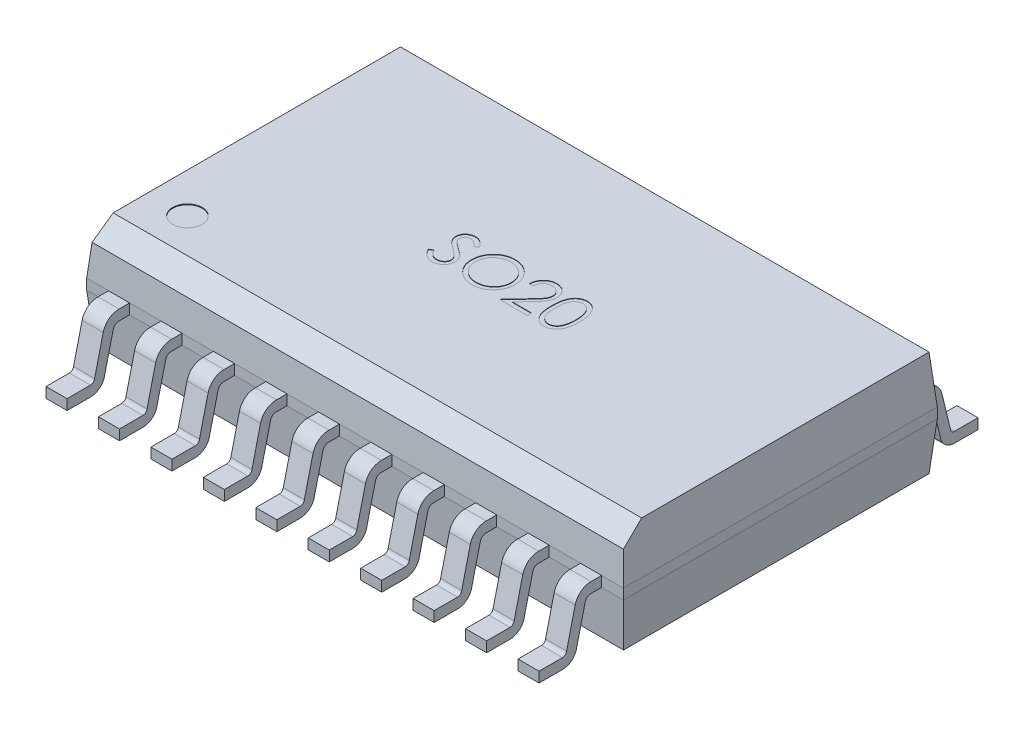
from build123d import *

# Parameters (mm, degrees)
BOSS_EXTRUDE1_DEPTH      = 0.125
BOSS_EXTRUDE1_DEPTH_BACK = 0.125
SKETCH1_W                = 13
SKETCH1_H                = 7.6
SKETCH2_W                = 13
SKETCH2_H                = 7.6
BOSS_EXTRUDE2_DEPTH      = 1.15
BOSS_EXTRUDE2_TAPER      = 5
SKETCH3_W                = 13
SKETCH3_H                = 7.6
BOSS_EXTRUDE3_DEPTH      = 1.15
BOSS_EXTRUDE3_TAPER      = 5
CHAMFER1_SIZE            = 0.4
CHAMFER1_SIZE2           = 0.440025147
BOSS_EXTRUDE4_START      = 0.38
BOSS_EXTRUDE4_DEPTH      = 0.51
LPATTERN1_COUNT          = 5
LPATTERN1_PITCH          = 1.27
LPATTERN1_COL_COUNT      = 6
LPATTERN1_COL_PITCH      = 1.27
SKETCH6_R                = 0.356697025
CUT_EXTRUDE1_DEPTH       = 0.02
CUT_EXTRUDE2_DEPTH       = 0.01


with BuildPart() as part:
    # Sketch1 → Boss-Extrude1 (new, two sides: drawn at the far end of the back side and taken through both)
    with BuildSketch(Plane(origin=(0, 1.38, 0), x_dir=(1, 0, 0), z_dir=(0, 1, 0)).offset(-BOSS_EXTRUDE1_DEPTH_BACK)):
        Rectangle(SKETCH1_W, SKETCH1_H)
    extrude(amount=BOSS_EXTRUDE1_DEPTH + BOSS_EXTRUDE1_DEPTH_BACK)

    # Sketch2 → Boss-Extrude2 (add)
    with BuildSketch(Plane(origin=(0, 1.505, 0), x_dir=(1, 0, 0), z_dir=(0, 1, 0))):
        Rectangle(SKETCH2_W, SKETCH2_H)
    extrude(amount=BOSS_EXTRUDE2_DEPTH, taper=BOSS_EXTRUDE2_TAPER)

    # Sketch3 → Boss-Extrude3 (add)
    with BuildSketch(Plane.XZ.offset(-1.255)):
        Rectangle(SKETCH3_W, SKETCH3_H)
    extrude(amount=BOSS_EXTRUDE3_DEPTH, taper=BOSS_EXTRUDE3_TAPER)

    # Chamfer1
    chamfer1_edges = [part.edges().sort_by_distance(p)[0] for p in [
        (0, 2.655, 3.699388037),
    ]]
    chamfer1_side = [part.faces().sort_by_distance(p)[0] for p in [
        (0, 2.078505048, 3.74982481),
    ]]
    chamfer(chamfer1_edges, length=CHAMFER1_SIZE, length2=CHAMFER1_SIZE2, reference=chamfer1_side[0])

    # Sketch5 → Boss-Extrude4 (add)
    with BuildSketch(Plane(origin=(0, 0, 0), x_dir=(0, 0, -1), z_dir=(1, 0, 0)).offset(BOSS_EXTRUDE4_START)):
        with BuildLine():
            Line((-3.8, 1.505), (-4.051930135, 1.50384621))
            ThreePointArc((-4.051930135, 1.50384621), (-4.2985369, 1.423103295), (-4.439894835, 1.205497574))
            Line((-4.439894835, 1.205497574), (-4.648230113, 0.342801804))
            ThreePointArc((-4.648230113, 0.342801804), (-4.68122576, 0.280101118), (-4.747483261, 0.255000675))
            Line((-4.747483261, 0.255000675), (-5.315, 0.255000675))
            Line((-5.315, 0.255000675), (-5.315, 0.005))
            Line((-5.315, 0.005), (-4.747480468, 0.005))
            ThreePointArc((-4.747480468, 0.005), (-4.515579214, 0.092851553), (-4.400094447, 0.312303953))
            Line((-4.400094447, 0.312303953), (-4.199570304, 1.133723513))
            ThreePointArc((-4.199570304, 1.133723513), (-4.14926214, 1.222682847), (-4.051930135, 1.25384621))
            Line((-4.051930135, 1.25384621), (-3.8, 1.255))
            Line((-3.8, 1.255), (-3.8, 1.505))
        make_face()
        with BuildLine():
            Line((4.648230113, 0.342801804), (4.439894835, 1.205497574))
            ThreePointArc((4.439894835, 1.205497574), (4.2985369, 1.423103295), (4.051930135, 1.50384621))
            Line((4.051930135, 1.50384621), (3.8, 1.505))
            Line((3.8, 1.505), (3.8, 1.255))
            Line((3.8, 1.255), (4.051930135, 1.25384621))
            ThreePointArc((4.051930135, 1.25384621), (4.14926214, 1.222682847), (4.199570304, 1.133723513))
            Line((4.199570304, 1.133723513), (4.400094447, 0.312303953))
            ThreePointArc((4.400094447, 0.312303953), (4.515580239, 0.092849981), (4.747483261, 0.00499782))
            Line((4.747483261, 0.00499782), (5.315002793, 0.00499782))
            Line((5.315002793, 0.00499782), (5.315002793, 0.255000675))
            Line((5.315002793, 0.255000675), (4.747483261, 0.255000675))
            ThreePointArc((4.747483261, 0.255000675), (4.68122576, 0.280101118), (4.648230113, 0.342801804))
        make_face()
    boss_extrude4 = extrude(amount=BOSS_EXTRUDE4_DEPTH)

    # LPattern1: Boss-Extrude4 ×5
    with Locations(*[(i * LPATTERN1_PITCH, 0, 0) for i in range(1, LPATTERN1_COUNT)]):
        add(boss_extrude4)

    # LPattern1 col: Boss-Extrude4 ×6
    with Locations(*[(-i * LPATTERN1_COL_PITCH, 0, 0) for i in range(1, LPATTERN1_COL_COUNT)]):
        add(boss_extrude4)

    # Sketch6 → Cut-Extrude1 (cut)
    with BuildSketch(Plane(origin=(0, 2.655, 0), x_dir=(1, 0, 0), z_dir=(0, 1, 0))):
        with Locations(Location((-5.435547395, -2.424163797, 0), (0, 0, 270))):
            Circle(SKETCH6_R)
    extrude(amount=-CUT_EXTRUDE1_DEPTH, mode=Mode.SUBTRACT)

    # Sketch7 → Cut-Extrude2 (cut)
    # profile 1 of 4: a face of its own
    with BuildSketch(Plane(origin=(0, 2.655, 0), x_dir=(1, 0, 0), z_dir=(0, 1, 0))):
        with BuildLine():
            Line((-1.820589586, -0.204070951), (-1.736054329, -0.153389861))
            add(Edge.make_bspline(
                [(-1.736054329, -0.153389861), (-1.728191976, -0.166551114), (-1.71312801, -0.191767567), (-1.68799905, -0.225841293), (-1.661961076, -0.254801909), (-1.634821266, -0.27848094), (-1.606745281, -0.297123479), (-1.577549837, -0.310324116), (-1.54733332, -0.318557252), (-1.526769371, -0.319557277), (-1.516503047, -0.320056528)],
                knots=[0, 0, 0, 0, 1.272034388, 2.437168799, 3.508375237, 4.49857839, 5.41946034, 6.295179144, 7.148887113, 8, 8, 8, 8], degree=3))
            add(Edge.make_bspline(
                [(-1.516503047, -0.320056528), (-1.507735373, -0.319812336), (-1.490353438, -0.319328224), (-1.464764226, -0.314676567), (-1.439912282, -0.307530244), (-1.416309814, -0.297295692), (-1.394282496, -0.284913268), (-1.374966297, -0.269957217), (-1.358267408, -0.253212587), (-1.34460766, -0.234531828), (-1.33412765, -0.214441214), (-1.326072774, -0.193819514), (-1.321602753, -0.17234278), (-1.320929395, -0.157882648), (-1.320589586, -0.150585374)],
                knots=[0, 0, 0, 0, 1.095163259, 2.171163733, 3.241058638, 4.321873601, 5.38011039, 6.391990106, 7.366004449, 8.327778327, 9.272591725, 10.192022065, 11.087607919, 12, 12, 12, 12], degree=3))
            add(Edge.make_bspline(
                [(-1.320589586, -0.150585374), (-1.321010817, -0.142259417), (-1.32186712, -0.125333963), (-1.329104686, -0.100362634), (-1.340490185, -0.075650471), (-1.350993797, -0.060364395), (-1.356446958, -0.052428323)],
                knots=[0, 0, 0, 0, 0.938893495, 1.908633276, 2.914225137, 4, 4, 4, 4], degree=3))
            add(Edge.make_bspline(
                [(-1.356446958, -0.052428323), (-1.360924276, -0.046700659), (-1.370323846, -0.034676145), (-1.386483135, -0.016777506), (-1.405444882, 0.001684899), (-1.426560183, 0.021416058), (-1.450598209, 0.041498286), (-1.47680607, 0.062889222), (-1.505852887, 0.084775387), (-1.526224172, 0.099453263), (-1.536735419, 0.107026805)],
                knots=[0, 0, 0, 0, 0.722233717, 1.516239348, 2.393582979, 3.351407094, 4.387010283, 5.505090956, 6.712668013, 8, 8, 8, 8], degree=3))
            add(Edge.make_bspline(
                [(-1.536735419, 0.107026805), (-1.547256561, 0.114520687), (-1.567372183, 0.12884842), (-1.595503206, 0.150112501), (-1.620658767, 0.169553606), (-1.642727058, 0.187354753), (-1.661698371, 0.203518354), (-1.677722203, 0.217889194), (-1.690390362, 0.230855925), (-1.697434814, 0.239267737), (-1.700597599, 0.243044434)],
                knots=[0, 0, 0, 0, 1.452282411, 2.77665338, 3.964542531, 5.026858415, 5.96415736, 6.766646006, 7.446254459, 8, 8, 8, 8], degree=3))
            add(Edge.make_bspline(
                [(-1.700597599, 0.243044434), (-1.705018326, 0.248930444), (-1.713712279, 0.260506074), (-1.725188281, 0.27859889), (-1.734942327, 0.297119823), (-1.742588708, 0.316118642), (-1.749027628, 0.335328621), (-1.753358465, 0.355000406), (-1.756070293, 0.375045725), (-1.756348003, 0.388535297), (-1.756487022, 0.395288023)],
                knots=[0, 0, 0, 0, 1.068054152, 2.10047183, 3.106115577, 4.101338837, 5.06977816, 6.043150881, 7.020423561, 8, 8, 8, 8], degree=3))
            add(Edge.make_bspline(
                [(-1.756487022, 0.395288023), (-1.756114105, 0.405867959), (-1.755376242, 0.426801691), (-1.749136094, 0.457381929), (-1.739286696, 0.486578048), (-1.725488157, 0.514101), (-1.707700342, 0.539234138), (-1.687115777, 0.562266563), (-1.66259821, 0.581629015), (-1.63569746, 0.598546746), (-1.606252783, 0.611788439), (-1.575398239, 0.62177729), (-1.54308479, 0.627437078), (-1.52119818, 0.628249296), (-1.510092791, 0.628661421)],
                knots=[0, 0, 0, 0, 1.005424448, 1.989358655, 2.955360095, 3.929531133, 4.905563448, 5.876582895, 6.856512386, 7.866279853, 8.892233794, 9.918561126, 10.94386622, 12, 12, 12, 12], degree=3))
            add(Edge.make_bspline(
                [(-1.510092791, 0.628661421), (-1.498308762, 0.628254977), (-1.47487409, 0.627446691), (-1.440402886, 0.620418825), (-1.40721411, 0.608790062), (-1.380516034, 0.595593302), (-1.359620959, 0.582412898), (-1.343685893, 0.570407234), (-1.32753805, 0.556585774), (-1.311047177, 0.540911704), (-1.294492703, 0.523241204), (-1.277628859, 0.503695293), (-1.260416211, 0.482393419), (-1.249343108, 0.467186419), (-1.243666509, 0.459390587)],
                knots=[0, 0, 0, 0, 1.286793592, 2.559021753, 3.825965368, 5.121522368, 5.803751409, 6.523245864, 7.299691795, 8.125521123, 9.008227632, 9.944561021, 10.946284179, 12, 12, 12, 12], degree=3))
            Line((-1.243666509, 0.459390587), (-1.324796317, 0.39789219))
            add(Edge.make_bspline(
                [(-1.324796317, 0.39789219), (-1.329695154, 0.404203244), (-1.339129171, 0.41635686), (-1.353451881, 0.433377235), (-1.366951495, 0.448924801), (-1.380251609, 0.462429123), (-1.39264979, 0.474629733), (-1.40468323, 0.485075378), (-1.416178759, 0.493868405), (-1.430669305, 0.503252279), (-1.448874367, 0.512554137), (-1.471727092, 0.520425302), (-1.495608885, 0.52515532), (-1.511874494, 0.525780717), (-1.520108817, 0.526097318)],
                knots=[0, 0, 0, 0, 1.181633172, 2.275549214, 3.290209073, 4.226197932, 5.078386478, 5.862611352, 6.581680152, 7.217281963, 8.414376989, 9.595101626, 10.782541182, 12, 12, 12, 12], degree=3))
            add(Edge.make_bspline(
                [(-1.520108817, 0.526097318), (-1.530439252, 0.525751118), (-1.550360522, 0.525083504), (-1.578643447, 0.51779208), (-1.604098854, 0.506311548), (-1.625971015, 0.490221554), (-1.64418158, 0.471158414), (-1.657354569, 0.449221598), (-1.665283187, 0.424998054), (-1.666250695, 0.408100438), (-1.666743432, 0.399494754)],
                knots=[0, 0, 0, 0, 1.14458467, 2.207223713, 3.21896685, 4.227309161, 5.202851033, 6.127160689, 7.046193047, 8, 8, 8, 8], degree=3))
            add(Edge.make_bspline(
                [(-1.666743432, 0.399494754), (-1.66663111, 0.394137189), (-1.666406283, 0.383413297), (-1.663270626, 0.367570034), (-1.659242246, 0.351766794), (-1.652858637, 0.336074628), (-1.644045694, 0.320219097), (-1.632472786, 0.303927172), (-1.617897554, 0.287055255), (-1.606732693, 0.276081719), (-1.600837983, 0.270288023)],
                knots=[0, 0, 0, 0, 0.858281714, 1.717966888, 2.583508476, 3.4729293, 4.427298488, 5.488583878, 6.674047936, 8, 8, 8, 8], degree=3))
            add(Edge.make_bspline(
                [(-1.600837983, 0.270288023), (-1.59864902, 0.268334587), (-1.593448543, 0.263693671), (-1.583941136, 0.256095876), (-1.571386051, 0.246723656), (-1.556111136, 0.235127279), (-1.537834747, 0.221675433), (-1.516554874, 0.206540115), (-1.492508722, 0.189229984), (-1.475445317, 0.17712783), (-1.466422919, 0.170728728)],
                knots=[0, 0, 0, 0, 0.420754252, 0.999615792, 1.744751191, 2.668019286, 3.750313428, 4.999500688, 6.413464383, 8, 8, 8, 8], degree=3))
            add(Edge.make_bspline(
                [(-1.466422919, 0.170728728), (-1.455569801, 0.162831197), (-1.434554242, 0.147538722), (-1.404652076, 0.124562814), (-1.37753956, 0.102092023), (-1.353121502, 0.080269849), (-1.331156671, 0.059261823), (-1.311888751, 0.0388152), (-1.295121413, 0.019076465), (-1.277070208, -0.006229986), (-1.258625117, -0.037310295), (-1.242784686, -0.075389792), (-1.232796587, -0.113617312), (-1.231490439, -0.139310694), (-1.230845996, -0.151987618)],
                knots=[0, 0, 0, 0, 1.163667725, 2.253281268, 3.268753668, 4.215851969, 5.092017293, 5.902905408, 6.650798638, 7.335211899, 8.59617414, 9.77448103, 10.901945474, 12, 12, 12, 12], degree=3))
            add(Edge.make_bspline(
                [(-1.230845996, -0.151987618), (-1.23103375, -0.160952865), (-1.231405611, -0.17870926), (-1.235680158, -0.204782139), (-1.24194292, -0.230105245), (-1.251382129, -0.254365563), (-1.262903032, -0.278006924), (-1.27752196, -0.300409181), (-1.294467012, -0.322068152), (-1.313905231, -0.342406292), (-1.335175489, -0.361076634), (-1.357656544, -0.377684937), (-1.381385194, -0.39153303), (-1.406232713, -0.40283327), (-1.432204809, -0.411671418), (-1.459292747, -0.418075095), (-1.487541179, -0.422005298), (-1.506741317, -0.42241323), (-1.516503047, -0.422620631)],
                knots=[0, 0, 0, 0, 0.983748083, 1.948392443, 2.894712957, 3.844097841, 4.80183111, 5.778335162, 6.776009319, 7.81870978, 8.863265674, 9.881300176, 10.883814829, 11.87499822, 12.874611388, 13.892143829, 14.928324115, 16, 16, 16, 16], degree=3))
            add(Edge.make_bspline(
                [(-1.516503047, -0.422620631), (-1.524056003, -0.422474579), (-1.539066791, -0.422184314), (-1.5612695, -0.419618234), (-1.583023669, -0.415987633), (-1.604056321, -0.410223613), (-1.624638438, -0.403230191), (-1.644680505, -0.394619239), (-1.664192235, -0.384300039), (-1.683282973, -0.37250146), (-1.701904166, -0.358770676), (-1.719881156, -0.342778248), (-1.737803781, -0.324965247), (-1.755143037, -0.304847943), (-1.77224965, -0.282751348), (-1.788786338, -0.258468724), (-1.8050954, -0.232132337), (-1.815328391, -0.213599456), (-1.820589586, -0.204070951)],
                knots=[0, 0, 0, 0, 0.915332311, 1.819136955, 2.706846663, 3.586547465, 4.459518054, 5.340707479, 6.227863349, 7.133153174, 8.059268498, 9.028702269, 10.047606654, 11.120612155, 12.245963614, 13.433783089, 14.680604001, 16, 16, 16, 16], degree=3))
        make_face()
    # profile 2 of 4: a face of its own
    with BuildSketch(Plane(origin=(0, 2.655, 0), x_dir=(1, 0, 0), z_dir=(0, 1, 0))):
        with BuildLine():
            add(Edge.make_bspline(
                [(-0.557769073, 0.628661421), (-0.539252471, 0.628192427), (-0.502884338, 0.627271283), (-0.449434367, 0.620220111), (-0.398407197, 0.608021428), (-0.349387157, 0.591774862), (-0.302960593, 0.57010218), (-0.258778052, 0.543906424), (-0.216944659, 0.51291315), (-0.178024265, 0.477361942), (-0.142407993, 0.438680955), (-0.111029169, 0.397401552), (-0.08473137, 0.353773323), (-0.063135431, 0.307927371), (-0.046192971, 0.259967381), (-0.034501816, 0.209637665), (-0.027033773, 0.157264325), (-0.026160694, 0.121542364), (-0.025717791, 0.103421036)],
                knots=[0, 0, 0, 0, 1.065120563, 2.091984664, 3.0946048, 4.079830382, 5.057816894, 6.036188127, 7.030412546, 8.04752943, 9.064399622, 10.05169764, 11.02544977, 11.989514704, 12.962713494, 13.945757189, 14.957906945, 16, 16, 16, 16], degree=3))
            add(Edge.make_bspline(
                [(-0.025717791, 0.103421036), (-0.026160629, 0.085433194), (-0.027033514, 0.049977074), (-0.034510307, -0.00206391), (-0.046236307, -0.052089823), (-0.062978097, -0.100017153), (-0.084471091, -0.145896456), (-0.110943997, -0.189607015), (-0.1421272, -0.231163157), (-0.177614872, -0.270109633), (-0.216300884, -0.305823196), (-0.257795246, -0.336942875), (-0.301164766, -0.363721196), (-0.34696754, -0.38508796), (-0.394596122, -0.402165652), (-0.444476786, -0.41380926), (-0.496375801, -0.421319844), (-0.531767516, -0.422182277), (-0.549756253, -0.422620631)],
                knots=[0, 0, 0, 0, 1.043624062, 2.057103931, 3.04512605, 4.022047818, 4.998200453, 5.980619268, 6.982898556, 8.009068085, 9.034988726, 10.034168286, 11.015286542, 11.987931943, 12.962482838, 13.94673481, 14.956375938, 16, 16, 16, 16], degree=3))
            add(Edge.make_bspline(
                [(-0.549756253, -0.422620631), (-0.567877487, -0.422177949), (-0.603599262, -0.421305305), (-0.656038415, -0.413824903), (-0.706403485, -0.402127388), (-0.754550443, -0.385410406), (-0.800506137, -0.363805483), (-0.844360446, -0.337461375), (-0.885937345, -0.306202192), (-0.92489213, -0.270726027), (-0.960534758, -0.232105584), (-0.991608865, -0.190724368), (-1.017958898, -0.147394238), (-1.039491279, -0.101994945), (-1.056538267, -0.054745962), (-1.068168215, -0.005332111), (-1.075692773, 0.045964891), (-1.076559872, 0.080891433), (-1.076999842, 0.098613344)],
                knots=[0, 0, 0, 0, 1.053102029, 2.075944431, 3.073151272, 4.055350789, 5.033113405, 6.020478099, 7.024410459, 8.052272461, 9.079885166, 10.07527673, 11.055994387, 12.023226415, 12.992069828, 13.970394897, 14.97016774, 16, 16, 16, 16], degree=3))
            add(Edge.make_bspline(
                [(-1.076999842, 0.098613344), (-1.076847089, 0.110508392), (-1.07654351, 0.134148427), (-1.072888741, 0.16925317), (-1.067585398, 0.203793358), (-1.059984851, 0.237670772), (-1.050044375, 0.270802482), (-1.038315224, 0.303416986), (-1.023989554, 0.335183764), (-1.007795083, 0.366253304), (-0.989720281, 0.396141277), (-0.969755781, 0.424392587), (-0.948602819, 0.4512443), (-0.925413278, 0.476000587), (-0.900951436, 0.499381632), (-0.874820471, 0.521028122), (-0.84717983, 0.541135251), (-0.817910579, 0.559255349), (-0.787733929, 0.575643673), (-0.756626278, 0.589707059), (-0.725010115, 0.601777362), (-0.692737358, 0.611560455), (-0.659893709, 0.619283894), (-0.626407485, 0.624543138), (-0.592305363, 0.628207228), (-0.5693307, 0.628509372), (-0.557769073, 0.628661421)],
                knots=[0, 0, 0, 0, 1.037015668, 2.060948919, 3.074880161, 4.083647147, 5.086022904, 6.090072063, 7.104153813, 8.122640571, 9.144368836, 10.147691507, 11.138137339, 12.123020368, 13.103399296, 14.087645067, 15.080126199, 16.082011238, 17.087798457, 18.072939717, 19.057185487, 20.037253025, 21.01195951, 21.997135196, 22.992090687, 24, 24, 24, 24], degree=3))
        make_face()
        with BuildLine():
            add(Edge.make_bspline(
                [(-0.553362022, 0.526097318), (-0.562851917, 0.525981635), (-0.581740984, 0.525751375), (-0.60982228, 0.522718314), (-0.637534261, 0.518395488), (-0.66488265, 0.512229339), (-0.691753018, 0.503828182), (-0.71839583, 0.494159351), (-0.744568131, 0.482381896), (-0.770183519, 0.469075409), (-0.795016398, 0.454347146), (-0.818448598, 0.438069498), (-0.840540782, 0.420624197), (-0.861238858, 0.401970529), (-0.88048205, 0.3820135), (-0.898649108, 0.361055661), (-0.915011846, 0.338497978), (-0.930007725, 0.314952148), (-0.943427108, 0.290448839), (-0.955360066, 0.265246021), (-0.965121212, 0.23913811), (-0.97308189, 0.212408351), (-0.979681836, 0.185099077), (-0.983862958, 0.15700312), (-0.986929346, 0.12826166), (-0.987146445, 0.108838273), (-0.987256253, 0.099013985)],
                knots=[0, 0, 0, 0, 1.008559885, 2.007477868, 2.99961109, 3.989939068, 4.984837346, 5.991145699, 7.001802488, 8.033829008, 9.059044045, 10.069351652, 11.065060232, 12.050310815, 13.029377138, 14.011219647, 14.996725999, 15.989392538, 16.977580475, 17.965360261, 18.951710183, 19.937753436, 20.929683414, 21.935841486, 22.955955122, 24, 24, 24, 24], degree=3))
            add(Edge.make_bspline(
                [(-0.987256253, 0.099013985), (-0.986892006, 0.084567636), (-0.986175421, 0.056147199), (-0.97990183, 0.014499158), (-0.970238408, -0.025526067), (-0.955993447, -0.06370947), (-0.938178985, -0.100379265), (-0.916171302, -0.135210152), (-0.890097278, -0.168211544), (-0.860479127, -0.19915305), (-0.828101211, -0.227394708), (-0.793720431, -0.252184254), (-0.757705115, -0.273158611), (-0.719961343, -0.290245774), (-0.680690617, -0.303785699), (-0.639639888, -0.313065308), (-0.597082614, -0.319172581), (-0.568073856, -0.319759083), (-0.553362022, -0.320056528)],
                knots=[0, 0, 0, 0, 1.032063989, 2.030389145, 3.003944642, 3.970395727, 4.937377036, 5.913328081, 6.909231446, 7.93887556, 8.970685674, 9.976071282, 10.964166581, 11.944589148, 12.933237628, 13.927779006, 14.949070134, 16, 16, 16, 16], degree=3))
            add(Edge.make_bspline(
                [(-0.553362022, -0.320056528), (-0.543473593, -0.31992067), (-0.523861868, -0.319651222), (-0.494691719, -0.316937314), (-0.466047087, -0.312585351), (-0.43796815, -0.30631945), (-0.410486775, -0.298477391), (-0.38348826, -0.289160897), (-0.357260177, -0.277537696), (-0.331471652, -0.264695424), (-0.306787011, -0.250055379), (-0.283222574, -0.234330193), (-0.261372294, -0.216910588), (-0.240689702, -0.19853407), (-0.221367505, -0.178830113), (-0.203536367, -0.157824335), (-0.187256329, -0.135384148), (-0.172266144, -0.111874032), (-0.158893783, -0.087303674), (-0.147242612, -0.06200948), (-0.137358008, -0.036053735), (-0.129378435, -0.009399), (-0.123125446, 0.0179041), (-0.118816897, 0.045892122), (-0.115803058, 0.074509077), (-0.115575893, 0.093864465), (-0.115461381, 0.103621357)],
                knots=[0, 0, 0, 0, 1.047197238, 2.076906641, 3.100256066, 4.114471768, 5.12198147, 6.126382909, 7.136867548, 8.15857795, 9.17633901, 10.174870724, 11.156907918, 12.133735059, 13.104061851, 14.077631395, 15.04955518, 16.038496417, 17.029181396, 18.010275684, 18.986308667, 19.968651475, 20.955262928, 21.950658345, 22.966943676, 24, 24, 24, 24], degree=3))
            add(Edge.make_bspline(
                [(-0.115461381, 0.103621357), (-0.115575984, 0.113311501), (-0.115803322, 0.132533686), (-0.118815458, 0.160951063), (-0.123129998, 0.188737695), (-0.129347914, 0.215784496), (-0.137362244, 0.24209836), (-0.147244338, 0.267654574), (-0.158897281, 0.292548344), (-0.172271059, 0.316718143), (-0.187304152, 0.339910925), (-0.203731079, 0.362083043), (-0.221835464, 0.382818112), (-0.241100042, 0.402628025), (-0.262006009, 0.421090279), (-0.284458665, 0.438210999), (-0.30818543, 0.454403363), (-0.333307497, 0.469010666), (-0.359234341, 0.482500447), (-0.385838329, 0.494057877), (-0.412818072, 0.503878482), (-0.440104961, 0.512254758), (-0.467928669, 0.518371338), (-0.496101192, 0.522722209), (-0.524583551, 0.52575032), (-0.543738757, 0.525981285), (-0.553362022, 0.526097318)],
                knots=[0, 0, 0, 0, 1.02996197, 2.043119294, 3.035359645, 4.018872909, 4.991431989, 5.957985074, 6.929999688, 7.912076566, 8.892894881, 9.867085534, 10.843653904, 11.817741046, 12.803660682, 13.806313499, 14.818574707, 15.856120519, 16.894564902, 17.924820532, 18.937903209, 19.946497019, 20.957711757, 21.963978472, 22.977135795, 24, 24, 24, 24], degree=3))
        make_face(mode=Mode.SUBTRACT)
    # profile 3 of 4: a face of its own
    with BuildSketch(Plane(origin=(0, 2.655, 0), x_dir=(1, 0, 0), z_dir=(0, 1, 0))):
        with BuildLine():
            Line((0.217871953, 0.295328087), (0.128128363, 0.295328087))
            add(Edge.make_bspline(
                [(0.128128363, 0.295328087), (0.128713264, 0.307234055), (0.129861993, 0.330617059), (0.135241505, 0.364709604), (0.142938898, 0.397296689), (0.153822171, 0.428116665), (0.16733825, 0.457442038), (0.183546829, 0.485156329), (0.202745072, 0.511153811), (0.224518425, 0.535193481), (0.248166608, 0.557247072), (0.27368259, 0.576291427), (0.300495455, 0.592382191), (0.328523855, 0.605833974), (0.358084016, 0.615931073), (0.38890769, 0.62342297), (0.4211303, 0.627930497), (0.443084592, 0.628415007), (0.454250158, 0.628661421)],
                knots=[0, 0, 0, 0, 1.10065271, 2.161652631, 3.183658789, 4.190468796, 5.17591951, 6.163126047, 7.15150782, 8.156236427, 9.156009102, 10.134482811, 11.092018607, 12.041330605, 13.001268258, 13.972401359, 14.968799086, 16, 16, 16, 16], degree=3))
            add(Edge.make_bspline(
                [(0.454250158, 0.628661421), (0.465215322, 0.628404719), (0.486761477, 0.627900309), (0.518207767, 0.623568586), (0.548144137, 0.616784132), (0.57651207, 0.607265441), (0.603085232, 0.59446989), (0.628063244, 0.579099165), (0.651743476, 0.56132207), (0.6730597, 0.540392409), (0.692633437, 0.518048871), (0.709519795, 0.494195184), (0.723980699, 0.469558246), (0.736034322, 0.443950188), (0.744907505, 0.417129894), (0.751644136, 0.389487836), (0.755451968, 0.36073789), (0.756036375, 0.341278874), (0.756333491, 0.33138578)],
                knots=[0, 0, 0, 0, 1.111607364, 2.184268762, 3.212621178, 4.221274766, 5.211760367, 6.196651075, 7.1921475, 8.207485113, 9.220403448, 10.201281604, 11.166441695, 12.114753415, 13.065576456, 14.026450734, 14.996634279, 16, 16, 16, 16], degree=3))
            add(Edge.make_bspline(
                [(0.756333491, 0.33138578), (0.755849702, 0.317457827), (0.754890613, 0.289846337), (0.746686505, 0.249270662), (0.733873216, 0.209958257), (0.7184454, 0.178319028), (0.702881845, 0.152823744), (0.688856842, 0.131832685), (0.672438325, 0.109231123), (0.653387326, 0.085094741), (0.632097933, 0.059234482), (0.608377315, 0.031665969), (0.582056321, 0.002674035), (0.563582463, -0.017127566), (0.554009773, -0.027388259)],
                knots=[0, 0, 0, 0, 1.184426356, 2.348067706, 3.509069118, 4.696110526, 5.333549288, 6.050745305, 6.844228056, 7.710549037, 8.667450064, 9.695053472, 10.805634456, 12, 12, 12, 12], degree=3))
            Line((0.554009773, -0.027388259), (0.303809453, -0.294415502))
            Line((0.303809453, -0.294415502), (0.769154004, -0.294415502))
            Line((0.769154004, -0.294415502), (0.769154004, -0.396979605))
            Line((0.769154004, -0.396979605), (0.089666824, -0.396979605))
            Line((0.089666824, -0.396979605), (0.477487337, 0.016882575))
            add(Edge.make_bspline(
                [(0.477487337, 0.016882575), (0.486929591, 0.026739234), (0.505066227, 0.045671858), (0.530718392, 0.073312704), (0.553758103, 0.09895543), (0.574334501, 0.122551587), (0.592001216, 0.14444632), (0.607678997, 0.163930521), (0.620240594, 0.181860364), (0.633873565, 0.202643397), (0.647077559, 0.228018345), (0.658423947, 0.25902797), (0.665342475, 0.290950042), (0.666172428, 0.312522053), (0.666589901, 0.323372959)],
                knots=[0, 0, 0, 0, 1.329631726, 2.553950428, 3.673215718, 4.687767853, 5.603093632, 6.413772471, 7.123043292, 7.734684054, 8.834405432, 9.900288307, 10.943827018, 12, 12, 12, 12], degree=3))
            add(Edge.make_bspline(
                [(0.666589901, 0.323372959), (0.666408261, 0.330196216), (0.666050282, 0.343643545), (0.66289094, 0.363359476), (0.658116509, 0.382377994), (0.651275007, 0.400757599), (0.64224451, 0.4183135), (0.631252116, 0.435067066), (0.61856924, 0.451263913), (0.603897449, 0.46645057), (0.587779872, 0.480359485), (0.570752944, 0.492680653), (0.552738628, 0.502977541), (0.533812879, 0.511418541), (0.514028459, 0.518040078), (0.493347103, 0.522628244), (0.471825956, 0.525508953), (0.457130671, 0.525898717), (0.449642786, 0.526097318)],
                knots=[0, 0, 0, 0, 0.991446411, 1.95395049, 2.89581595, 3.838931463, 4.798493298, 5.75982156, 6.748411868, 7.785213223, 8.824556874, 9.840280684, 10.836137867, 11.835679398, 12.848801643, 13.863922112, 14.911575587, 16, 16, 16, 16], degree=3))
            add(Edge.make_bspline(
                [(0.449642786, 0.526097318), (0.441822548, 0.525893023), (0.426464892, 0.525491822), (0.403916597, 0.522685346), (0.382406375, 0.517843678), (0.361880117, 0.511221771), (0.342303092, 0.502805042), (0.323770508, 0.492321687), (0.306323968, 0.479812117), (0.289930676, 0.465629101), (0.274826682, 0.449838358), (0.261556146, 0.432235511), (0.249960713, 0.413141964), (0.23984379, 0.392609235), (0.231627878, 0.370451013), (0.225349835, 0.346745954), (0.220382165, 0.321596988), (0.218722587, 0.304229821), (0.217871953, 0.295328087)],
                knots=[0, 0, 0, 0, 1.031018746, 2.02475058, 2.990194455, 3.934040569, 4.864654155, 5.795059489, 6.735614925, 7.690564532, 8.649604399, 9.611025574, 10.590972636, 11.591080095, 12.624614302, 13.701020113, 14.821632451, 16, 16, 16, 16], degree=3))
        make_face()
    # profile 4 of 4: a face of its own
    with BuildSketch(Plane(origin=(0, 2.655, 0), x_dir=(1, 0, 0), z_dir=(0, 1, 0))):
        with BuildLine():
            add(Edge.make_bspline(
                [(0.858897594, 0.102619754), (0.858991313, 0.118647579), (0.859173365, 0.14978186), (0.861198628, 0.195148901), (0.864563011, 0.237708983), (0.869173689, 0.277464145), (0.874784541, 0.314424649), (0.88227468, 0.348491723), (0.890792623, 0.379823039), (0.900664751, 0.408520767), (0.911804119, 0.434971539), (0.923928193, 0.459664454), (0.937518135, 0.482562149), (0.951797253, 0.504030089), (0.967343559, 0.523716859), (0.983714642, 0.541900477), (1.001549464, 0.558160691), (1.020241752, 0.572973921), (1.039960742, 0.585959484), (1.06014436, 0.597397409), (1.080931534, 0.6071688), (1.102379014, 0.614851782), (1.124294031, 0.621197738), (1.146753193, 0.625537437), (1.169793583, 0.628267982), (1.185345421, 0.62852903), (1.19323253, 0.628661421)],
                knots=[0, 0, 0, 0, 1.646270934, 3.197905019, 4.663502075, 6.030701355, 7.308322542, 8.50163776, 9.611534131, 10.641858119, 11.616356847, 12.558055219, 13.465016945, 14.349605745, 15.204443733, 16.039544428, 16.859896111, 17.680448484, 18.487036065, 19.28249412, 20.06191084, 20.843045899, 21.620316918, 22.403196591, 23.190181807, 24, 24, 24, 24], degree=3))
            add(Edge.make_bspline(
                [(1.19323253, 0.628661421), (1.201185523, 0.628522045), (1.217001526, 0.62824487), (1.24038449, 0.625580887), (1.263227256, 0.621160566), (1.285432439, 0.61489743), (1.307182435, 0.607127237), (1.328307123, 0.597388061), (1.348937718, 0.586051241), (1.368746371, 0.572730134), (1.387950547, 0.557878055), (1.406078537, 0.541088721), (1.42313199, 0.522531658), (1.439324934, 0.502405411), (1.454197962, 0.480323958), (1.4683618, 0.456671356), (1.481039524, 0.431033966), (1.493249431, 0.403839546), (1.50378857, 0.374335644), (1.513293212, 0.342688569), (1.520972917, 0.308524516), (1.527369852, 0.272022732), (1.532325537, 0.233049165), (1.535934863, 0.191687361), (1.537841459, 0.147910106), (1.538200516, 0.117979292), (1.538384773, 0.102619754)],
                knots=[0, 0, 0, 0, 0.810914788, 1.612654377, 2.396697861, 3.181598691, 3.963628158, 4.749916497, 5.551656086, 6.361998678, 7.18212741, 8.025565596, 8.878627764, 9.750805457, 10.657531673, 11.591944965, 12.560506719, 13.57287815, 14.630710178, 15.753379473, 16.941251878, 18.199788006, 19.531962791, 20.947069417, 22.433333509, 24, 24, 24, 24], degree=3))
            add(Edge.make_bspline(
                [(1.538384773, 0.102619754), (1.538198606, 0.087327209), (1.537835867, 0.057530308), (1.535956237, 0.01395003), (1.532253771, -0.027192268), (1.527622345, -0.065995258), (1.521207785, -0.102297434), (1.513320594, -0.13622442), (1.504563359, -0.167922726), (1.493753418, -0.197132672), (1.481921786, -0.224261736), (1.469048873, -0.249595207), (1.455257494, -0.273357005), (1.440232139, -0.295356932), (1.424216878, -0.315750834), (1.406868938, -0.334178727), (1.388677342, -0.351084633), (1.369416652, -0.366127955), (1.349299066, -0.379295042), (1.32873933, -0.391070428), (1.307372649, -0.400565484), (1.285683234, -0.408718352), (1.263360843, -0.414947053), (1.240433303, -0.419253869), (1.217017236, -0.422274397), (1.201188217, -0.42250482), (1.19323253, -0.422620631)],
                knots=[0, 0, 0, 0, 1.561518951, 3.042555995, 4.452378317, 5.7783523, 7.031515105, 8.214008947, 9.334062868, 10.386615937, 11.391082383, 12.354592575, 13.286541444, 14.194233754, 15.072674879, 15.931287219, 16.775624067, 17.606195743, 18.42308326, 19.229000347, 20.022332153, 20.807536673, 21.593273796, 22.3848459, 23.188221202, 24, 24, 24, 24], degree=3))
            add(Edge.make_bspline(
                [(1.19323253, -0.422620631), (1.18534564, -0.422487386), (1.169794233, -0.422224654), (1.146750683, -0.419506445), (1.12438427, -0.415136301), (1.102584626, -0.409017272), (1.081239908, -0.401527318), (1.060640969, -0.391769123), (1.040558773, -0.380530818), (1.0210469, -0.367732126), (1.002471997, -0.353068788), (0.984729538, -0.33685042), (0.968265247, -0.318672302), (0.95294122, -0.298821467), (0.938377195, -0.277480541), (0.924980231, -0.254358148), (0.912588558, -0.229545974), (0.901261847, -0.202883714), (0.891219371, -0.173982306), (0.882348598, -0.142511112), (0.875344553, -0.108192359), (0.869349422, -0.071301682), (0.864513884, -0.031680559), (0.861212649, 0.01069252), (0.859172273, 0.055791151), (0.858990824, 0.086725372), (0.858897594, 0.102619754)],
                knots=[0, 0, 0, 0, 0.810891512, 1.598919785, 2.382837074, 3.152667961, 3.926044502, 4.706494248, 5.493654104, 6.291793342, 7.103789334, 7.925228297, 8.761435821, 9.622817696, 10.50288917, 11.416980706, 12.369136599, 13.353924996, 14.394355917, 15.514179734, 16.714354668, 17.994756427, 19.357759367, 20.818452758, 22.365282078, 24, 24, 24, 24], degree=3))
        make_face()
        with BuildLine():
            add(Edge.make_bspline(
                [(0.948641183, 0.103020395), (0.948675311, 0.089663624), (0.948741546, 0.063740754), (0.950471889, 0.026071251), (0.952829099, -0.009063129), (0.955869469, -0.041706996), (0.960384597, -0.071749857), (0.96544368, -0.099398338), (0.971600277, -0.12450612), (0.978884567, -0.147245494), (0.987181452, -0.168002371), (0.99624027, -0.187317004), (1.005971906, -0.205417557), (1.016863091, -0.222141445), (1.028724538, -0.237543207), (1.041288326, -0.251895444), (1.05502335, -0.264694582), (1.07402442, -0.280045112), (1.099109127, -0.295907722), (1.130714971, -0.30972089), (1.163191671, -0.318401592), (1.185234886, -0.319505522), (1.196237337, -0.320056528)],
                knots=[0, 0, 0, 0, 1.459021318, 2.831673884, 4.118529203, 5.306027144, 6.411944654, 7.436330062, 8.375795394, 9.233974572, 10.042671642, 10.816086306, 11.563610507, 12.285937304, 12.993564865, 13.685989202, 14.367179055, 15.041617293, 16.353048772, 17.594441528, 18.799311195, 20, 20, 20, 20], degree=3))
            add(Edge.make_bspline(
                [(1.196237337, -0.320056528), (1.207310958, -0.319600019), (1.229435336, -0.318687944), (1.261759277, -0.309888305), (1.293139354, -0.296611294), (1.317731337, -0.280912006), (1.336440635, -0.265961055), (1.34984549, -0.253214013), (1.362148932, -0.238940908), (1.373818096, -0.223541109), (1.384520689, -0.206720399), (1.394253015, -0.188559663), (1.403133971, -0.16900847), (1.408193698, -0.155359973), (1.410780606, -0.148381849)],
                knots=[0, 0, 0, 0, 1.353760809, 2.704726607, 4.075137775, 5.516104923, 6.260822281, 7.007110065, 7.778089737, 8.566572457, 9.372053459, 10.217411131, 11.088608312, 12, 12, 12, 12], degree=3))
            add(Edge.make_bspline(
                [(1.410780606, -0.148381849), (1.413795397, -0.139459066), (1.419916715, -0.12134199), (1.427805794, -0.09323809), (1.434018765, -0.063751586), (1.439608298, -0.033058695), (1.443423457, -0.000933066), (1.446494261, 0.0325259), (1.448303028, 0.067343432), (1.448527243, 0.090999144), (1.448641183, 0.103020395)],
                knots=[0, 0, 0, 0, 0.884706709, 1.796334032, 2.740027952, 3.714592787, 4.726048262, 5.777819803, 6.87074269, 8, 8, 8, 8], degree=3))
            add(Edge.make_bspline(
                [(1.448641183, 0.103020395), (1.448483986, 0.115039701), (1.448176476, 0.138552034), (1.447001051, 0.1729858), (1.443965744, 0.205690875), (1.440594567, 0.236808153), (1.435623932, 0.266165382), (1.430264559, 0.294008326), (1.423064212, 0.319992048), (1.415372848, 0.344523357), (1.406569878, 0.367323544), (1.396879668, 0.388498911), (1.386530594, 0.40815169), (1.375289954, 0.426227959), (1.363291188, 0.442808685), (1.350217602, 0.457561427), (1.336587781, 0.470943418), (1.317497157, 0.486218437), (1.292504503, 0.501793207), (1.261405746, 0.516126282), (1.229042705, 0.524357222), (1.207164575, 0.525517704), (1.196237337, 0.526097318)],
                knots=[0, 0, 0, 0, 1.31362396, 2.569729283, 3.763502607, 4.902122613, 5.988968491, 7.01645872, 7.998833611, 8.933434873, 9.825090667, 10.667526885, 11.477055099, 12.250526234, 12.991942729, 13.710640831, 14.402115721, 15.076753259, 16.378508321, 17.609869233, 18.806226677, 20, 20, 20, 20], degree=3))
            add(Edge.make_bspline(
                [(1.196237337, 0.526097318), (1.185177168, 0.525516905), (1.163036681, 0.524355021), (1.130337265, 0.516156948), (1.098993165, 0.501867529), (1.0740666, 0.486166852), (1.054962661, 0.471213048), (1.041510463, 0.45824549), (1.028897271, 0.444060846), (1.017277928, 0.428517442), (1.006395276, 0.411813051), (0.996400701, 0.393816261), (0.98739575, 0.374435871), (0.979085882, 0.353688318), (0.971779371, 0.330950906), (0.965752525, 0.30587405), (0.960184795, 0.27831351), (0.95624329, 0.248107936), (0.95273936, 0.215455892), (0.950487546, 0.180233801), (0.948735758, 0.142501121), (0.94867334, 0.116444219), (0.948641183, 0.103020395)],
                knots=[0, 0, 0, 0, 1.207732386, 2.417664972, 3.655092373, 4.956220595, 5.625982001, 6.301752483, 6.994047911, 7.697131622, 8.419323945, 9.170223765, 9.943494443, 10.752040957, 11.610060368, 12.549350801, 13.567764191, 14.679664412, 15.874934091, 17.154273443, 18.533957287, 20, 20, 20, 20], degree=3))
        make_face(mode=Mode.SUBTRACT)
    extrude(amount=-CUT_EXTRUDE2_DEPTH, mode=Mode.SUBTRACT)


solid = part.part
